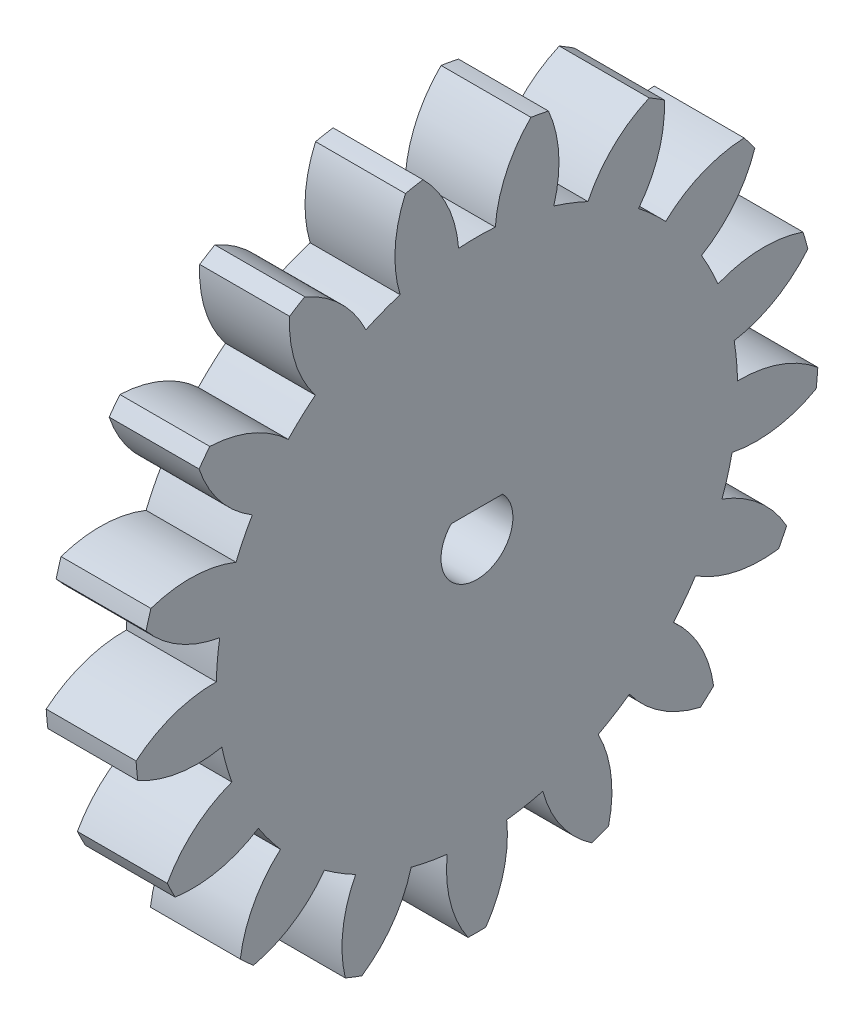
from build123d import *

# Parameters (mm, degrees)
BASPROSKE_W         = 5
BASPROSKE_H         = 19
TOOTHCUT_DEPTH      = 28.331300737
TEETHCUTS_COUNT     = 17
TEETHCUTS_ANGLE     = 338.823529412
BORSKE_R            = 2
BORE_DEPTH          = 50.0000508
BOSS_EXTRUDE1_DEPTH = 5


with BuildPart() as part:
    # BasProSke → Base-Revolve (revolve)
    with BuildSketch(Plane(origin=(0, 0, 0), x_dir=(1, 0, 0), z_dir=(0, 1, 0)), mode=Mode.PRIVATE) as base_revolve_sk:
        with Locations((2.5, 9.5)):
            Rectangle(BASPROSKE_W, BASPROSKE_H)
    revolve(base_revolve_sk.sketch.rotate(Axis((-10, 0, 0), (1, 0, 0)), 180), axis=Axis((-10, 0, 0), (1, 0, 0)))

    # TooCutSke → ToothCut (cut, through all)
    with BuildSketch(Plane(origin=(0, 0, 0), x_dir=(0, 0, -1), z_dir=(1, 0, 0))):
        with BuildLine():
            ThreePointArc((1.020352389, 14.463052306), (0, 14.499), (-1.020352389, 14.463052306))
            ThreePointArc((-1.020352389, 14.463052306), (-1.632621885, 16.804485203), (-3.026143023, 18.783192049))
            ThreePointArc((-3.026143023, 18.783192049), (0, 19.0254), (3.026143023, 18.783192049))
            ThreePointArc((3.026143023, 18.783192049), (1.632621885, 16.804485203), (1.020352389, 14.463052306))
        make_face()
    toothcut = extrude(amount=TOOTHCUT_DEPTH, mode=Mode.SUBTRACT)

    # TeethCuts: ToothCut ×17 about axis
    teethcuts_axis = Axis((-10, 0, 0), (1, 0, 0))
    for i in range(1, TEETHCUTS_COUNT):
        add(toothcut.rotate(teethcuts_axis, i * TEETHCUTS_ANGLE / (TEETHCUTS_COUNT - 1)), mode=Mode.SUBTRACT)

    # BorSke → Bore (cut, symmetric)
    with BuildSketch(Plane(origin=(0, 0, 0), x_dir=(0, 0, -1), z_dir=(1, 0, 0))):
        with Locations(Location((0, 0, 0), (0, 0, 180))):
            Circle(BORSKE_R)
    extrude(amount=BORE_DEPTH, both=True, mode=Mode.SUBTRACT)

    # Sketch1 → Boss-Extrude1 (add)
    with BuildSketch(Plane(origin=(5, 0, 0), x_dir=(0, 0, -1), z_dir=(1, 0, 0))):
        with BuildLine():
            ThreePointArc((1.428285686, 1.4), (0, 2), (-1.428285686, 1.4))
            Line((-1.428285686, 1.4), (1.428285686, 1.4))
        make_face()
    extrude(amount=-BOSS_EXTRUDE1_DEPTH)


solid = part.part
